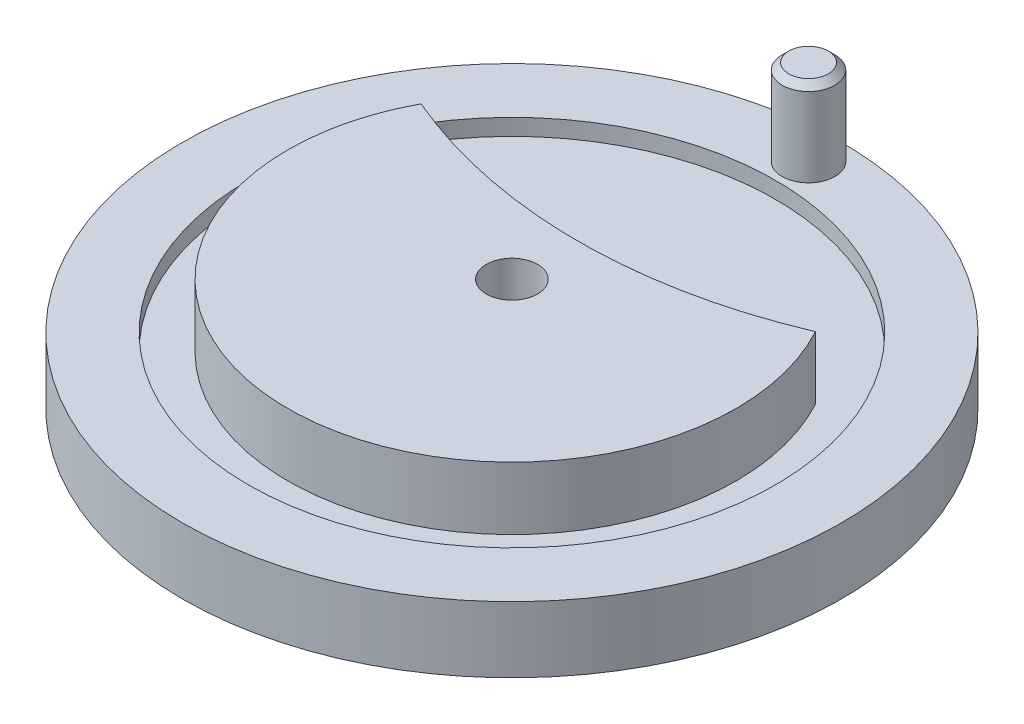
from build123d import *

# Parameters (mm, degrees)
SKETCH1_R           = 31.75
SKETCH1_R_2         = 2.4765
BOSS_EXTRUDE1_DEPTH = 6.35
SKETCH2_R           = 25.4
CUT_EXTRUDE1_DEPTH  = 1.5875
SKETCH3_R           = 2.4765
BOSS_EXTRUDE2_DEPTH = 6.0452
SKETCH4_R           = 2.54
BOSS_EXTRUDE3_DEPTH = 8.255
CHAMFER1_SIZE       = 0.635
SKETCH5_R           = 6.35
BOSS_EXTRUDE4_DEPTH = 3.302
SKETCH6_R           = 4.445
CUT_EXTRUDE2_DEPTH  = 6.604


with BuildPart() as part:
    # Sketch1 → Boss-Extrude1 (new body)
    with BuildSketch(Plane(origin=(0, 0, 0), x_dir=(1, 0, 0), z_dir=(0, 1, 0))):
        with Locations(Location((0, 0, 0), (0, 0, 270))):
            Circle(SKETCH1_R)
        with Locations(Location((0, 0, 0), (0, 0, 270))):
            Circle(SKETCH1_R_2, mode=Mode.SUBTRACT)
    extrude(amount=BOSS_EXTRUDE1_DEPTH)

    # Sketch2 → Cut-Extrude1 (cut)
    with BuildSketch(Plane(origin=(0, 6.35, 0), x_dir=(1, 0, 0), z_dir=(0, 1, 0))):
        with Locations(Location((0, 0, 0), (0, 0, 270))):
            Circle(SKETCH2_R)
    extrude(amount=-CUT_EXTRUDE1_DEPTH, mode=Mode.SUBTRACT)

    # Sketch3 → Boss-Extrude2 (add)
    with BuildSketch(Plane(origin=(0, 4.7625, 0), x_dir=(1, 0, 0), z_dir=(0, 1, 0))):
        with BuildLine():
            ThreePointArc((-19.002478857, 10.248604651), (0, -21.59), (19.002478857, 10.248604651))
            ThreePointArc((19.002478857, 10.248604651), (0, 6.35), (-19.002478857, 10.248604651))
        make_face()
        with Locations(Location((0, 0, 0), (0, 0, 270))):
            Circle(SKETCH3_R, mode=Mode.SUBTRACT)
    extrude(amount=BOSS_EXTRUDE2_DEPTH)

    # Sketch4 → Boss-Extrude3 (add)
    with BuildSketch(Plane(origin=(0, 6.35, 0), x_dir=(1, 0, 0), z_dir=(0, 1, 0))):
        with Locations(Location((0, 28.575, 0), (0, 0, 270))):
            Circle(SKETCH4_R)
    extrude(amount=BOSS_EXTRUDE3_DEPTH)

    # Chamfer1
    chamfer1_edges = [part.edges().sort_by_distance(p)[0] for p in [
        (0, 14.605, -31.115),
    ]]
    chamfer(chamfer1_edges, length=CHAMFER1_SIZE)

    # Sketch5 → Boss-Extrude4 (add)
    with BuildSketch(Plane.XZ):
        with Locations(Location((0, 0, 0), (0, 0, 90))):
            Circle(SKETCH5_R)
    extrude(amount=BOSS_EXTRUDE4_DEPTH)

    # Sketch6 → Cut-Extrude2 (cut)
    with BuildSketch(Plane.XZ.offset(3.302)):
        with Locations(Location((0, 0, 0), (0, 0, 270))):
            Circle(SKETCH6_R)
    extrude(amount=-CUT_EXTRUDE2_DEPTH, mode=Mode.SUBTRACT)


solid = part.part
